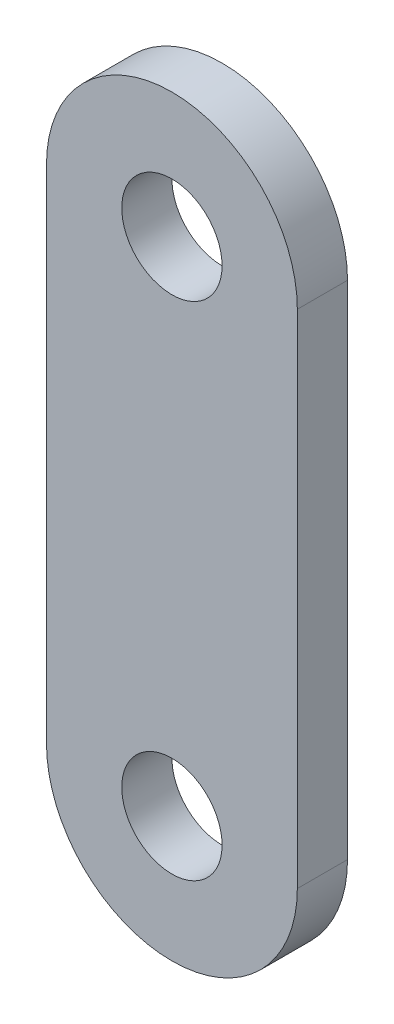
from build123d import *

# Parameters (mm, degrees)
CROQUIS1_R              = 10
SALIENTE_EXTRUIR1_DEPTH = 10


with BuildPart() as part:
    # Croquis1 → Saliente-Extruir1 (new body)
    with BuildSketch(Plane.XY):
        with BuildLine():
            Line((50, 0), (50, 100))
            ThreePointArc((50, 100), (25, 125), (0, 100))
            Line((0, 100), (0, 0))
            ThreePointArc((0, 0), (25, -25), (50, 0))
        make_face()
        with Locations((25, 100)):
            Circle(CROQUIS1_R, mode=Mode.SUBTRACT)
        with Locations((25, 0)):
            Circle(CROQUIS1_R, mode=Mode.SUBTRACT)
    extrude(amount=SALIENTE_EXTRUIR1_DEPTH)


solid = part.part
